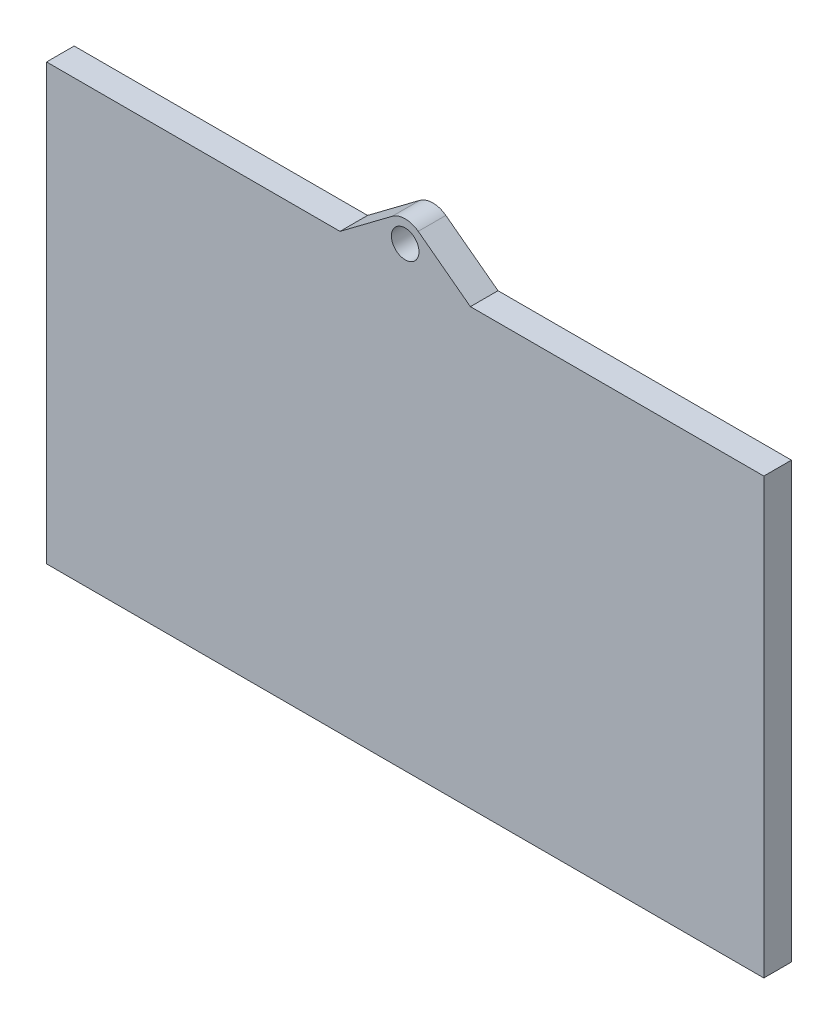
from build123d import *

# Parameters (mm, degrees)
SKETCH1_W           = 165
SKETCH1_H           = 100
BOSS_EXTRUDE1_DEPTH = 6.35
SKETCH2_R           = 3.175
BOSS_EXTRUDE2_DEPTH = 6.35


with BuildPart() as part:
    # Sketch1 → Boss-Extrude1 (new body)
    with BuildSketch(Plane.XY):
        Rectangle(SKETCH1_W, SKETCH1_H)
    extrude(amount=BOSS_EXTRUDE1_DEPTH)

    # Sketch2 → Boss-Extrude2 (add)
    with BuildSketch(Plane.XY.offset(6.35)):
        with BuildLine():
            Line((-3, 59), (-15, 50))
            Line((-15, 50), (15, 50))
            Line((15, 50), (3, 59))
            ThreePointArc((3, 59), (0, 60), (-3, 59))
        make_face()
        with Locations((0, 55)):
            Circle(SKETCH2_R, mode=Mode.SUBTRACT)
    extrude(amount=-BOSS_EXTRUDE2_DEPTH)


solid = part.part
